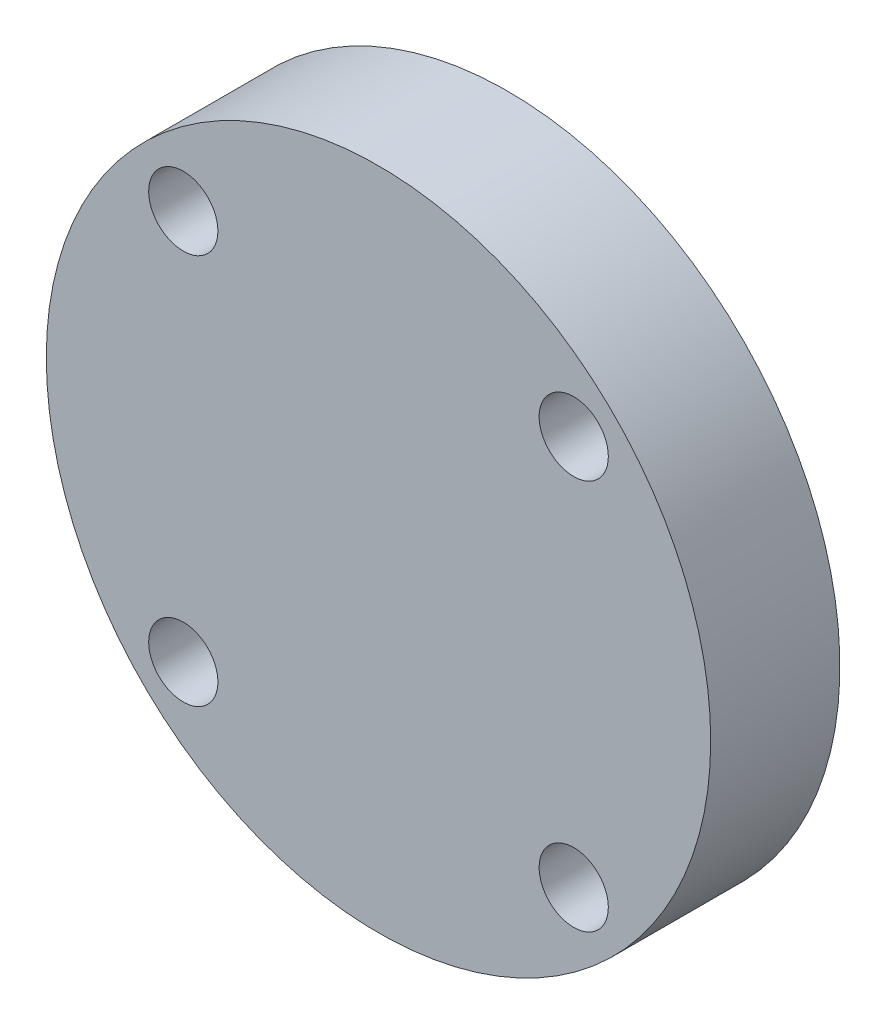
from build123d import *

# Parameters (mm, degrees)
SKETCH1_R           = 114.3
BOSS_EXTRUDE1_DEPTH = 25.4
CUT_EXTRUDE1_START  = -6.35
SKETCH2_R           = 114.3
SKETCH2_R_2         = 68.2498
CUT_EXTRUDE1_DEPTH  = 6.35
SKETCH3_R           = 77.9399
SKETCH3_R_2         = 73.3679
CUT_EXTRUDE2_DEPTH  = 2.5654
CUT_EXTRUDE3_REACH  = 171.439
SKETCH5_R           = 11.90625
CIRPATTERN1_COUNT   = 4


with BuildPart() as part:
    # Sketch1 → Boss-Extrude1 (new, symmetric)
    with BuildSketch(Plane.XY):
        Circle(SKETCH1_R)
    extrude(amount=BOSS_EXTRUDE1_DEPTH, both=True)

    # Sketch2 → Cut-Extrude1 (cut)
    with BuildSketch(Plane(origin=(0, 0, -25.4), x_dir=(-1, 0, 0), z_dir=(0, 0, -1)).offset(CUT_EXTRUDE1_START)):
        Circle(SKETCH2_R)
        Circle(SKETCH2_R_2, mode=Mode.SUBTRACT)
    extrude(amount=CUT_EXTRUDE1_DEPTH, mode=Mode.SUBTRACT)

    # Sketch3 → Cut-Extrude2 (cut)
    with BuildSketch(Plane(origin=(0, 0, -19.05), x_dir=(-1, 0, 0), z_dir=(0, 0, -1))):
        Circle(SKETCH3_R)
        Circle(SKETCH3_R_2, mode=Mode.SUBTRACT)
    extrude(amount=-CUT_EXTRUDE2_DEPTH, mode=Mode.SUBTRACT)

    # Sketch5 → Cut-Extrude3 (cut, up to next)
    with BuildSketch(Plane.XY.offset(25.4), mode=Mode.PRIVATE) as cut_extrude3_sk1:
        with Locations((67.172315786, 67.172315786)):
            Circle(SKETCH5_R)
    cut_extrude3_tool1 = extrude(cut_extrude3_sk1.sketch, amount=-CUT_EXTRUDE3_REACH, mode=Mode.PRIVATE) & part.part
    cut_extrude3 = cut_extrude3_tool1.solids().sort_by_distance((67.172316, 67.172316, 25.4))[0]
    add(cut_extrude3, mode=Mode.SUBTRACT)

    # CirPattern1: Cut-Extrude3 ×4 about axis
    cirpattern1_axis = Axis((0, 0, 0), (0, 0, 1))
    for i in range(1, CIRPATTERN1_COUNT):
        add(cut_extrude3.rotate(cirpattern1_axis, i * 360 / CIRPATTERN1_COUNT), mode=Mode.SUBTRACT)


solid = part.part
